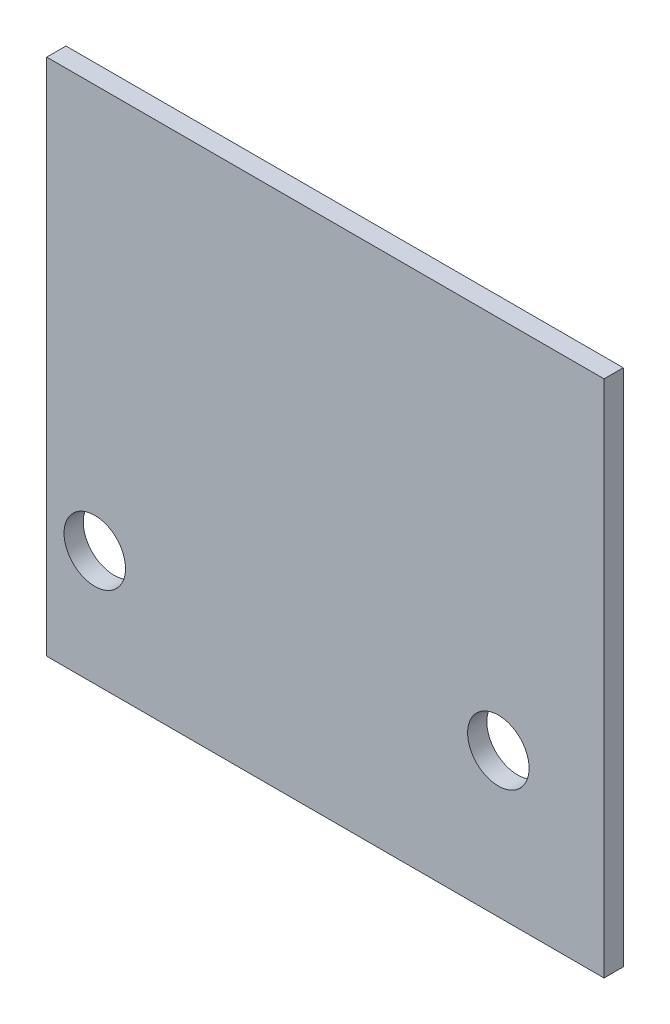
from build123d import *

# Parameters (mm, degrees)
SKETCH1_W           = 29
SKETCH1_H           = 27
BOSS_EXTRUDE1_DEPTH = 1
SKETCH2_R           = 1.6
CUT_EXTRUDE1_DEPTH  = 20.836834425


with BuildPart() as part:
    # Sketch1 → Boss-Extrude1 (new body)
    with BuildSketch(Plane.XY):
        Rectangle(SKETCH1_W, SKETCH1_H)
    extrude(amount=BOSS_EXTRUDE1_DEPTH)

    # Sketch2 → Cut-Extrude1 (cut, through all)
    with BuildSketch(Plane.XY.offset(1)):
        with Locations((9, -6)):
            Circle(SKETCH2_R)
        with Locations((-12, -7.5)):
            Circle(SKETCH2_R)
    extrude(amount=-CUT_EXTRUDE1_DEPTH, mode=Mode.SUBTRACT)


solid = part.part
